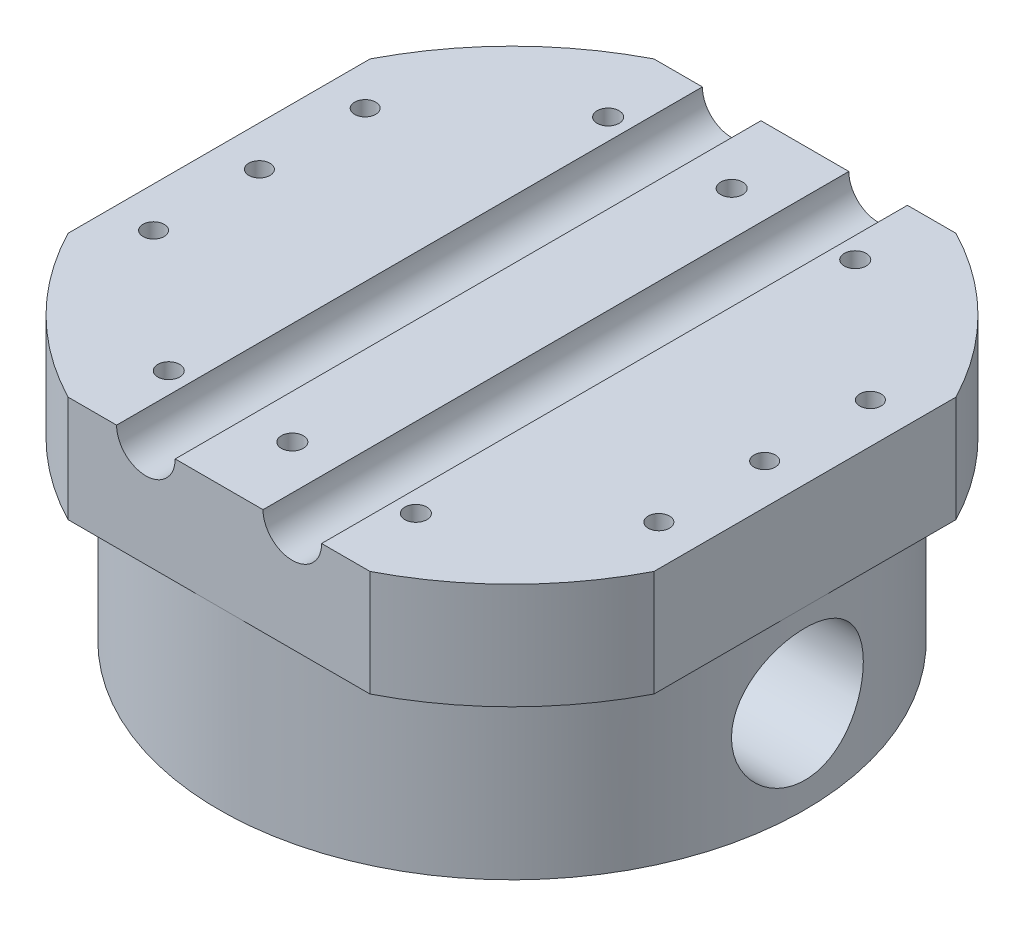
from build123d import *

# Parameters (mm, degrees)
SALIENTE_EXTRUIR1_DEPTH = 40
CROQUIS5_R              = 1.45
CORTAR_EXTRUIR3_DEPTH   = 15
CROQUIS6_R              = 4
CORTAR_EXTRUIR4_DEPTH   = 106
CROQUIS8_R              = 10.1
CORTAR_EXTRUIR5_DEPTH   = 27
CROQUIS9_R              = 3.75
CORTAR_EXTRUIR6_DEPTH   = 80
CROQUIS12_R             = 1.5
CORTAR_EXTRUIR8_DEPTH   = 15
CROQUIS16_W             = 80
CROQUIS16_H             = 3
CORTAR_EXTRUIR11_DEPTH  = 80
CROQUIS21_R             = 33
CROQUIS21_R_2           = 22.4
CORTAR_EXTRUIR12_DEPTH  = 1
SALIENTE_EXTRUIR2_START = 2.5
CROQUIS22_R             = 22.4
SALIENTE_EXTRUIR2_DEPTH = 2.5
SALIENTE_EXTRUIR3_START = 1.5
CROQUIS24_R             = 40
CROQUIS24_R_2           = 33
SALIENTE_EXTRUIR3_DEPTH = 1.5
CROQUIS25_R             = 13
CORTAR_EXTRUIR13_DEPTH  = 7
CROQUIS26_R             = 9
CORTAR_EXTRUIR14_DEPTH  = 24
CORTAR_EXTRUIR15_START  = -25.5
CROQUIS27_R             = 9
CORTAR_EXTRUIR15_DEPTH  = 25.5
CROQUIS28_R             = 45
CROQUIS28_R_2           = 40
CORTAR_EXTRUIR16_DEPTH  = 25


with BuildPart() as part:
    # Croquis1 → Saliente-Extruir1 (new body)
    with BuildSketch(Plane(origin=(0, 0, 0), x_dir=(1, 0, 0), z_dir=(0, 1, 0))):
        with BuildLine():
            ThreePointArc((-40, -20.615528128), (-31.819805153, -31.819805153), (-20.615528128, -40))
            Line((-20.615528128, -40), (20.615528128, -40))
            ThreePointArc((20.615528128, -40), (31.819805153, -31.819805153), (40, -20.615528128))
            Line((40, -20.615528128), (40, 20.615528128))
            ThreePointArc((40, 20.615528128), (31.819805153, 31.819805153), (20.615528128, 40))
            Line((20.615528128, 40), (-20.615528128, 40))
            ThreePointArc((-20.615528128, 40), (-31.819805153, 31.819805153), (-40, 20.615528128))
            Line((-40, 20.615528128), (-40, -20.615528128))
        make_face()
    extrude(amount=SALIENTE_EXTRUIR1_DEPTH)

    # Croquis5 → Cortar-Extruir3 (cut)
    with BuildSketch(Plane(origin=(0, 40, 0), x_dir=(1, 0, 0), z_dir=(0, 1, 0))):
        with Locations(Location((-34.5, 14.446020213, 0), (0, 0, 270))):
            Circle(CROQUIS5_R)
        with Locations(Location((-34.5, -14.446020213, 0), (0, 0, 270))):
            Circle(CROQUIS5_R)
        with Locations(Location((-34.5, 0, 0), (0, 0, 270))):
            Circle(CROQUIS5_R)
    cortar_extruir3 = extrude(amount=-CORTAR_EXTRUIR3_DEPTH, mode=Mode.SUBTRACT)

    # Simetría1: Cortar-Extruir3 across plane
    add(cortar_extruir3.mirror(Plane(origin=(0, 0, 0), x_dir=(0, 0, 1), z_dir=(1, 0, 0))), mode=Mode.SUBTRACT)

    # Croquis6 → Cortar-Extruir4 (cut)
    with BuildSketch(Plane.XY.offset(40)):
        with Locations((-10, 40)):
            Circle(CROQUIS6_R)
        with Locations((10, 40)):
            Circle(CROQUIS6_R)
    extrude(amount=-CORTAR_EXTRUIR4_DEPTH, mode=Mode.SUBTRACT)

    # Croquis8 → Cortar-Extruir5 (cut)
    with BuildSketch(Plane.XZ):
        with Locations(Location((0, 0, 0), (0, 0, 270))):
            Circle(CROQUIS8_R)
    extrude(amount=-CORTAR_EXTRUIR5_DEPTH, mode=Mode.SUBTRACT)

    # Croquis9 → Cortar-Extruir6 (cut)
    with BuildSketch(Plane.ZY.offset(40)):
        with Locations((0, 14)):
            Circle(CROQUIS9_R)
    extrude(amount=-CORTAR_EXTRUIR6_DEPTH, mode=Mode.SUBTRACT)

    # Croquis12 → Cortar-Extruir8 (cut)
    with BuildSketch(Plane(origin=(0, 40, 0), x_dir=(1, 0, 0), z_dir=(0, 1, 0))):
        with Locations(Location((-16.875, 30, 0), (0, 0, 270))):
            Circle(CROQUIS12_R)
        with Locations(Location((0, 30, 0), (0, 0, 270))):
            Circle(CROQUIS12_R)
        with Locations(Location((16.875, 30, 0), (0, 0, 270))):
            Circle(CROQUIS12_R)
        with Locations(Location((-16.875, -30, 0), (0, 0, 270))):
            Circle(CROQUIS12_R)
        with Locations(Location((0, -30, 0), (0, 0, 270))):
            Circle(CROQUIS12_R)
        with Locations(Location((16.875, -30, 0), (0, 0, 270))):
            Circle(CROQUIS12_R)
    extrude(amount=-CORTAR_EXTRUIR8_DEPTH, mode=Mode.SUBTRACT)

    # Croquis16 → Cortar-Extruir11 (cut)
    with BuildSketch(Plane(origin=(40, 0, 0), x_dir=(0, 0, -1), z_dir=(1, 0, 0))):
        with Locations((0, 1.5)):
            Rectangle(CROQUIS16_W, CROQUIS16_H)
    extrude(amount=-CORTAR_EXTRUIR11_DEPTH, mode=Mode.SUBTRACT)

    # Croquis21 → Cortar-Extruir12 (cut)
    with BuildSketch(Plane.XZ.offset(-3)):
        with Locations(Location((0, 0, 0), (0, 0, 270))):
            Circle(CROQUIS21_R)
        with Locations(Location((0, 0, 0), (0, 0, 270))):
            Circle(CROQUIS21_R_2, mode=Mode.SUBTRACT)
    extrude(amount=-CORTAR_EXTRUIR12_DEPTH, mode=Mode.SUBTRACT)

    # Croquis22 → Saliente-Extruir2 (add)
    with BuildSketch(Plane.XZ.offset(-3).offset(SALIENTE_EXTRUIR2_START)):
        with Locations(Location((0, 0, 0), (0, 0, 270))):
            Circle(CROQUIS22_R)
    extrude(amount=-SALIENTE_EXTRUIR2_DEPTH)

    # Croquis24 → Saliente-Extruir3 (add)
    with BuildSketch(Plane.XZ.offset(-3).offset(SALIENTE_EXTRUIR3_START)):
        with Locations(Location((0, 0, 0), (0, 0, 270))):
            Circle(CROQUIS24_R)
        with Locations(Location((0, 0, 0), (0, 0, 270))):
            Circle(CROQUIS24_R_2, mode=Mode.SUBTRACT)
    extrude(amount=-SALIENTE_EXTRUIR3_DEPTH)

    # Croquis25 → Cortar-Extruir13 (cut)
    with BuildSketch(Plane.XZ.offset(-0.5)):
        with Locations(Location((0, 0, 0), (0, 0, 270))):
            Circle(CROQUIS25_R)
    extrude(amount=-CORTAR_EXTRUIR13_DEPTH, mode=Mode.SUBTRACT)

    # Croquis26 → Cortar-Extruir14 (cut)
    with BuildSketch(Plane(origin=(40, 0, 0), x_dir=(0, 0, -1), z_dir=(1, 0, 0))):
        with Locations((0, 14)):
            Circle(CROQUIS26_R)
    extrude(amount=-CORTAR_EXTRUIR14_DEPTH, mode=Mode.SUBTRACT)

    # Croquis27 → Cortar-Extruir15 (cut)
    with BuildSketch(Plane.ZY.offset(40).offset(CORTAR_EXTRUIR15_START)):
        with Locations(Location((0, 14, 0), (0, 0, 180))):
            Circle(CROQUIS27_R)
    extrude(amount=CORTAR_EXTRUIR15_DEPTH, mode=Mode.SUBTRACT)

    # Croquis28 → Cortar-Extruir16 (cut)
    with BuildSketch(Plane.XZ.offset(-0.5)):
        Circle(CROQUIS28_R)
        with Locations(Location((0, 0, 0), (0, 0, 270))):
            Circle(CROQUIS28_R_2, mode=Mode.SUBTRACT)
    extrude(amount=-CORTAR_EXTRUIR16_DEPTH, mode=Mode.SUBTRACT)


solid = part.part
